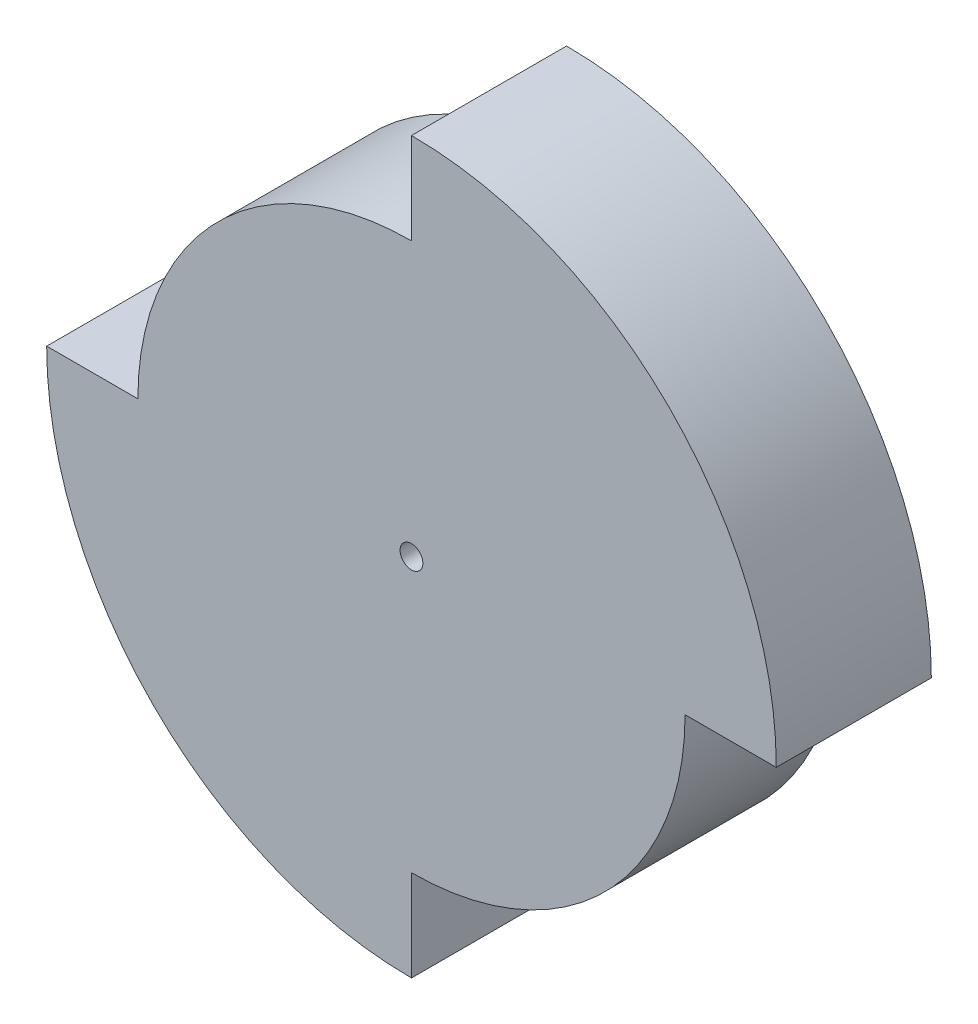
from build123d import *

# Parameters (mm, degrees)
ESQUISSE1_R             = 30
BOSS_EXTRU_1_DEPTH      = 17
ESQUISSE2_R             = 1.25
ENL_V_MAT_EXTRU_1_DEPTH = 100


with BuildPart() as part:
    # Esquisse1 → Boss.-Extru.1 (new body)
    with BuildSketch(Plane.XY):
        Circle(ESQUISSE1_R)
        with BuildLine():
            Line((0, 40), (0, 30))
            ThreePointArc((0, 30), (21.213203436, 21.213203436), (30, 0))
            Line((30, 0), (40, 0))
            ThreePointArc((40, 0), (28.284271247, 28.284271247), (0, 40))
        make_face()
        with BuildLine():
            ThreePointArc((0, -30), (-21.213203436, -21.213203436), (-30, 0))
            Line((-30, 0), (-40, 0))
            ThreePointArc((-40, 0), (-28.284271247, -28.284271247), (0, -40))
            Line((0, -40), (0, -30))
        make_face()
    extrude(amount=BOSS_EXTRU_1_DEPTH)

    # Esquisse2 → Enlèv. mat.-Extru.1 (cut)
    with BuildSketch(Plane.XY.offset(17)):
        Circle(ESQUISSE2_R)
    extrude(amount=-ENL_V_MAT_EXTRU_1_DEPTH, mode=Mode.SUBTRACT)


solid = part.part
